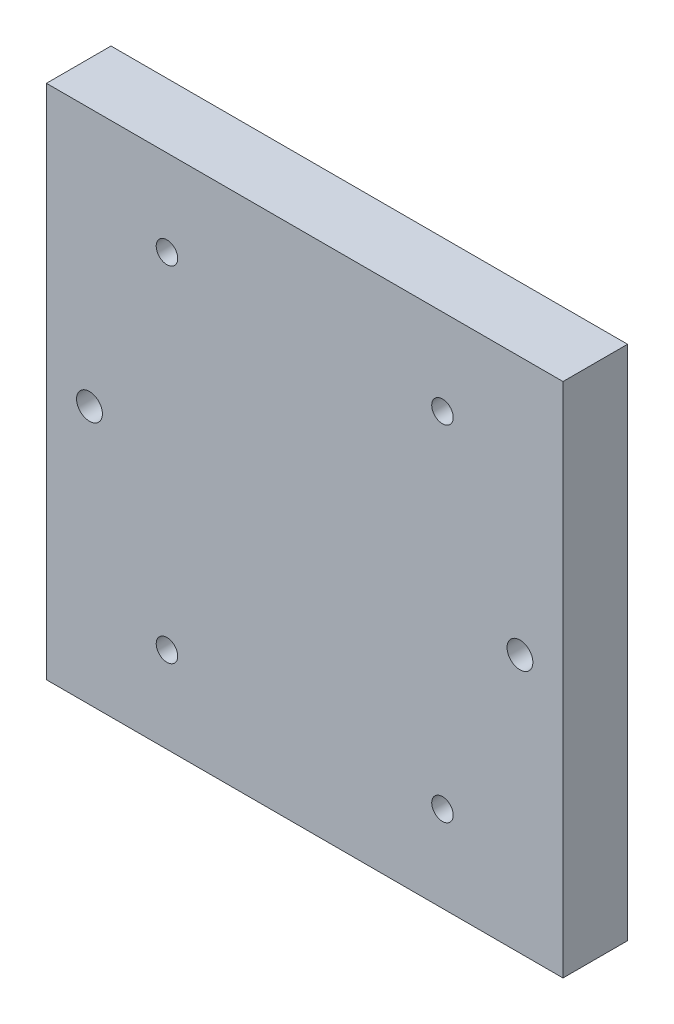
from build123d import *

# Parameters (mm, degrees)
SKETCH1_W           = 120
SKETCH1_H           = 120
BOSS_EXTRUDE1_DEPTH = 15
CUT_EXTRUDE4_REACH  = 88.168
SKETCH7_R           = 2.5
SKETCH7_R_2         = 3


with BuildPart() as part:
    # Sketch1 → Boss-Extrude1 (new body)
    with BuildSketch(Plane.XY):
        Rectangle(SKETCH1_W, SKETCH1_H)
    extrude(amount=-BOSS_EXTRUDE1_DEPTH)

    # Sketch7 → Cut-Extrude4 (cut, up to next)
    with BuildSketch(Plane(origin=(0, 0, -15), x_dir=(-1, 0, 0), z_dir=(0, 0, -1)), mode=Mode.PRIVATE) as cut_extrude4_sk1:
        with Locations((-32, -40)):
            Circle(SKETCH7_R)
    cut_extrude4_tool1 = extrude(cut_extrude4_sk1.sketch, amount=-CUT_EXTRUDE4_REACH, mode=Mode.PRIVATE) & part.part
    # Sketch7 → Cut-Extrude4 (cut, up to next)
    with BuildSketch(Plane(origin=(0, 0, -15), x_dir=(-1, 0, 0), z_dir=(0, 0, -1)), mode=Mode.PRIVATE) as cut_extrude4_sk2:
        with Locations((-32, 40)):
            Circle(SKETCH7_R)
    cut_extrude4_tool2 = extrude(cut_extrude4_sk2.sketch, amount=-CUT_EXTRUDE4_REACH, mode=Mode.PRIVATE) & part.part
    # Sketch7 → Cut-Extrude4 (cut, up to next)
    with BuildSketch(Plane(origin=(0, 0, -15), x_dir=(-1, 0, 0), z_dir=(0, 0, -1)), mode=Mode.PRIVATE) as cut_extrude4_sk3:
        with Locations((32, -40)):
            Circle(SKETCH7_R)
    cut_extrude4_tool3 = extrude(cut_extrude4_sk3.sketch, amount=-CUT_EXTRUDE4_REACH, mode=Mode.PRIVATE) & part.part
    # Sketch7 → Cut-Extrude4 (cut, up to next)
    with BuildSketch(Plane(origin=(0, 0, -15), x_dir=(-1, 0, 0), z_dir=(0, 0, -1)), mode=Mode.PRIVATE) as cut_extrude4_sk4:
        with Locations((32, 40)):
            Circle(SKETCH7_R)
    cut_extrude4_tool4 = extrude(cut_extrude4_sk4.sketch, amount=-CUT_EXTRUDE4_REACH, mode=Mode.PRIVATE) & part.part
    # Sketch7 → Cut-Extrude4 (cut, up to next)
    with BuildSketch(Plane(origin=(0, 0, -15), x_dir=(-1, 0, 0), z_dir=(0, 0, -1)), mode=Mode.PRIVATE) as cut_extrude4_sk5:
        with Locations((50, 0)):
            Circle(SKETCH7_R_2)
    cut_extrude4_tool5 = extrude(cut_extrude4_sk5.sketch, amount=-CUT_EXTRUDE4_REACH, mode=Mode.PRIVATE) & part.part
    # Sketch7 → Cut-Extrude4 (cut, up to next)
    with BuildSketch(Plane(origin=(0, 0, -15), x_dir=(-1, 0, 0), z_dir=(0, 0, -1)), mode=Mode.PRIVATE) as cut_extrude4_sk6:
        with Locations((-50, 0)):
            Circle(SKETCH7_R_2)
    cut_extrude4_tool6 = extrude(cut_extrude4_sk6.sketch, amount=-CUT_EXTRUDE4_REACH, mode=Mode.PRIVATE) & part.part
    add(cut_extrude4_tool1.solids().sort_by_distance((32, -40, -15))[0], mode=Mode.SUBTRACT)
    add(cut_extrude4_tool2.solids().sort_by_distance((32, 40, -15))[0], mode=Mode.SUBTRACT)
    add(cut_extrude4_tool3.solids().sort_by_distance((-32, -40, -15))[0], mode=Mode.SUBTRACT)
    add(cut_extrude4_tool4.solids().sort_by_distance((-32, 40, -15))[0], mode=Mode.SUBTRACT)
    add(cut_extrude4_tool5.solids().sort_by_distance((-50, 0, -15))[0], mode=Mode.SUBTRACT)
    add(cut_extrude4_tool6.solids().sort_by_distance((50, 0, -15))[0], mode=Mode.SUBTRACT)


solid = part.part
